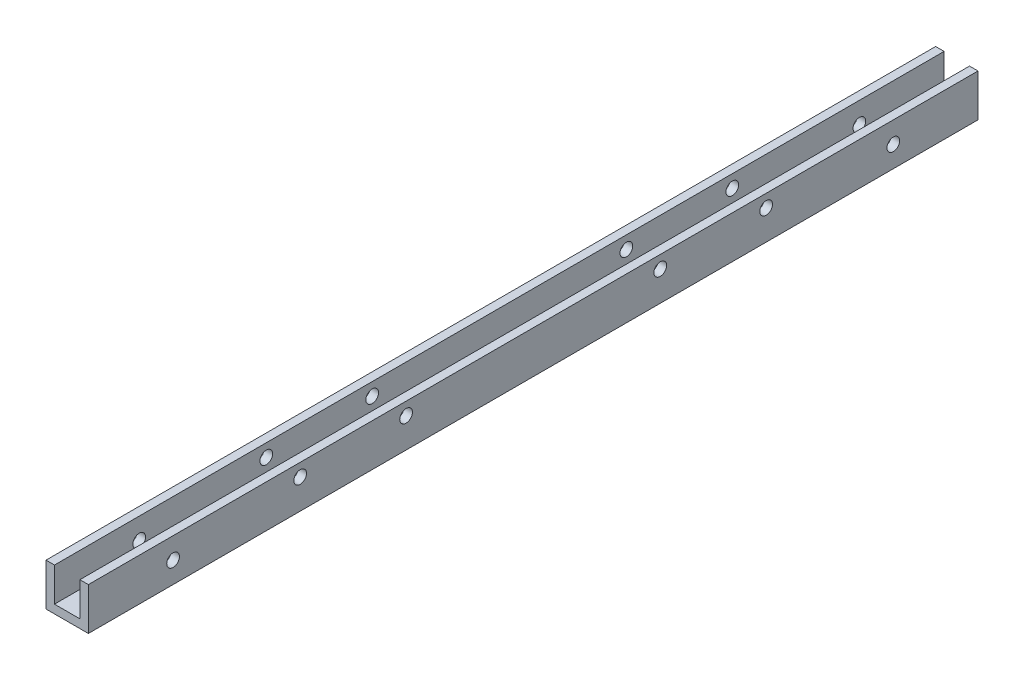
from build123d import *

# Parameters (mm, degrees)
EXTRUDE_1_DEPTH     = 210
SKETCH_2_R          = 1.5
CUT_EXTRUDE_1_DEPTH = 10
SKETCH_3_R          = 1.5
CUT_EXTRUDE_2_DEPTH = 10
SKETCH_5_R          = 2.5
CUT_EXTRUDE_3_DEPTH = 10


with BuildPart() as part:
    # 草图1 → 凸台-拉伸1 (new body)
    with BuildSketch(Plane.XY):
        Polygon((2.52173913, 3.673913043), (4.52173913, 3.673913043), (4.52173913, -6.326086957), (-5.47826087, -6.326086957), (-5.47826087, 3.673913043), (-3.47826087, 3.673913043), (-3.47826087, -4.326086957), (2.52173913, -4.326086957), align=None)
    extrude(amount=EXTRUDE_1_DEPTH)

    # 草图2 → 切除-拉伸1 (cut)
    with BuildSketch(Plane(origin=(4.52173913, 0, 0), x_dir=(0, 0, -1), z_dir=(1, 0, 0))):
        with Locations(Location((-160, 0.673913043, 0), (0, 0, 90))):
            Circle(SKETCH_2_R)
        with Locations(Location((-135, 0.673913043, 0), (0, 0, 90))):
            Circle(SKETCH_2_R)
        with Locations(Location((-75, 0.673913043, 0), (0, 0, 90))):
            Circle(SKETCH_2_R)
        with Locations(Location((-50, 0.673913043, 0), (0, 0, 90))):
            Circle(SKETCH_2_R)
    extrude(amount=-CUT_EXTRUDE_1_DEPTH, mode=Mode.SUBTRACT)

    # 草图3 → 切除-拉伸2 (cut)
    with BuildSketch(Plane(origin=(4.52173913, 0, 0), x_dir=(0, 0, -1), z_dir=(1, 0, 0))):
        with Locations(Location((-20, -1.326086957, 0), (0, 0, 90))):
            Circle(SKETCH_3_R)
        with Locations(Location((-190, -1.326086957, 0), (0, 0, 90))):
            Circle(SKETCH_3_R)
    extrude(amount=-CUT_EXTRUDE_2_DEPTH, mode=Mode.SUBTRACT)

    # 草图5 → 切除-拉伸3 (cut)
    with BuildSketch(Plane.XZ.offset(6.326086957)):
        with Locations((-0.47826087, 105)):
            Circle(SKETCH_5_R)
    extrude(amount=-CUT_EXTRUDE_3_DEPTH, mode=Mode.SUBTRACT)


solid = part.part
